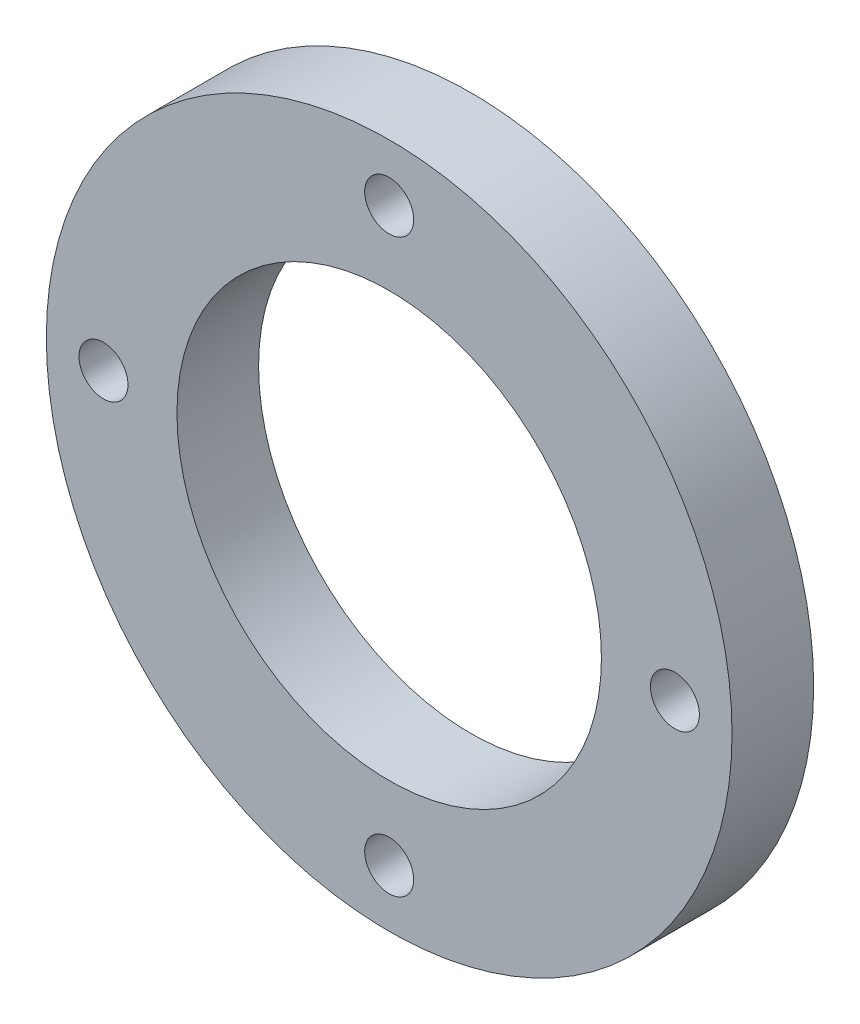
from build123d import *

# Parameters (mm, degrees)
SKETCH1_R           = 21
SKETCH1_R_2         = 13
SKETCH1_R_3         = 1.5
BOSS_EXTRUDE1_DEPTH = 5


with BuildPart() as part:
    # Sketch1 → Boss-Extrude1 (new body)
    with BuildSketch(Plane.XY):
        with Locations((49, 5)):
            Circle(SKETCH1_R)
        with Locations((49, 5)):
            Circle(SKETCH1_R_2, mode=Mode.SUBTRACT)
        with Locations((31.5, 5)):
            Circle(SKETCH1_R_3, mode=Mode.SUBTRACT)
        with Locations((49, 22.5)):
            Circle(SKETCH1_R_3, mode=Mode.SUBTRACT)
        with Locations((66.5, 5)):
            Circle(SKETCH1_R_3, mode=Mode.SUBTRACT)
        with Locations((49, -12.5)):
            Circle(SKETCH1_R_3, mode=Mode.SUBTRACT)
    extrude(amount=BOSS_EXTRUDE1_DEPTH)


solid = part.part
